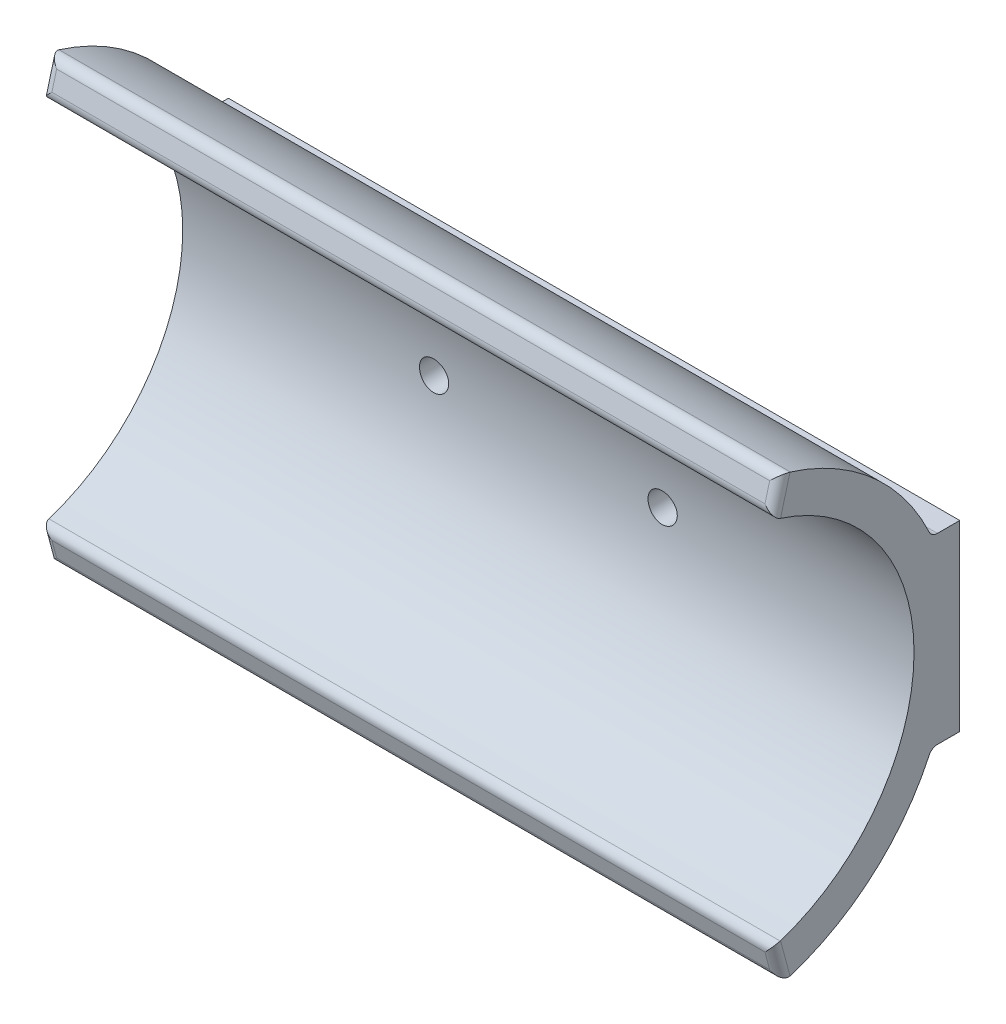
from build123d import *

# Parameters (mm, degrees)
BOSS_EXTRUDE1_DEPTH     = 40
CUT_EXTRUDE1_DEPTH      = 52.04942644
CUT_EXTRUDE1_DEPTH_BACK = 52.04942644
SKETCH2_R               = 1.6
FILLET1_R               = 1


with BuildPart() as part:
    # Sketch1 → Boss-Extrude1 (new, symmetric)
    with BuildSketch(Plane.YZ):
        with BuildLine():
            Line((20.284442352, -5.435199947), (24.148145657, -6.470476128))
            ThreePointArc((24.148145657, -6.470476128), (18.950253605, -16.306069064), (10, -22.912878475))
            Line((10, -22.912878475), (10, -26))
            Line((10, -26), (-10, -26))
            Line((-10, -26), (-10, -22.912878475))
            ThreePointArc((-10, -22.912878475), (-18.950253605, -16.306069064), (-24.148145657, -6.470476128))
            Line((-24.148145657, -6.470476128), (-20.284442352, -5.435199947))
            ThreePointArc((-20.284442352, -5.435199947), (0, -21), (20.284442352, -5.435199947))
        make_face()
    extrude(amount=BOSS_EXTRUDE1_DEPTH, both=True)

    # Sketch2 → Cut-Extrude1 (cut, two sides: drawn at the far end of the back side and taken through both)
    with BuildSketch(Plane(origin=(0, 0, -26), x_dir=(-1, 0, 0), z_dir=(0, 0, -1)).offset(-CUT_EXTRUDE1_DEPTH_BACK)):
        with Locations((12.5, 0)):
            Circle(SKETCH2_R)
        with Locations((-12.5, 0)):
            Circle(SKETCH2_R)
    extrude(amount=CUT_EXTRUDE1_DEPTH + CUT_EXTRUDE1_DEPTH_BACK, mode=Mode.SUBTRACT)

    # Fillet1
    fillet1_edges = [part.edges().sort_by_distance(p)[0] for p in [
        (-40, -22.216294005, -5.952838037),
        (0, 20.284442352, -5.435199947),
        (0, 24.148145657, -6.470476128),
        (0, 10, -22.912878475),
        (0, -10, -22.912878475),
        (0, -24.148145657, -6.470476128),
        (0, -20.284442352, -5.435199947),
        (40, 22.216294005, -5.952838037),
        (-40, 22.216294005, -5.952838037),
        (40, -22.216294005, -5.952838037),
    ]]
    fillet(fillet1_edges, radius=FILLET1_R)


solid = part.part
